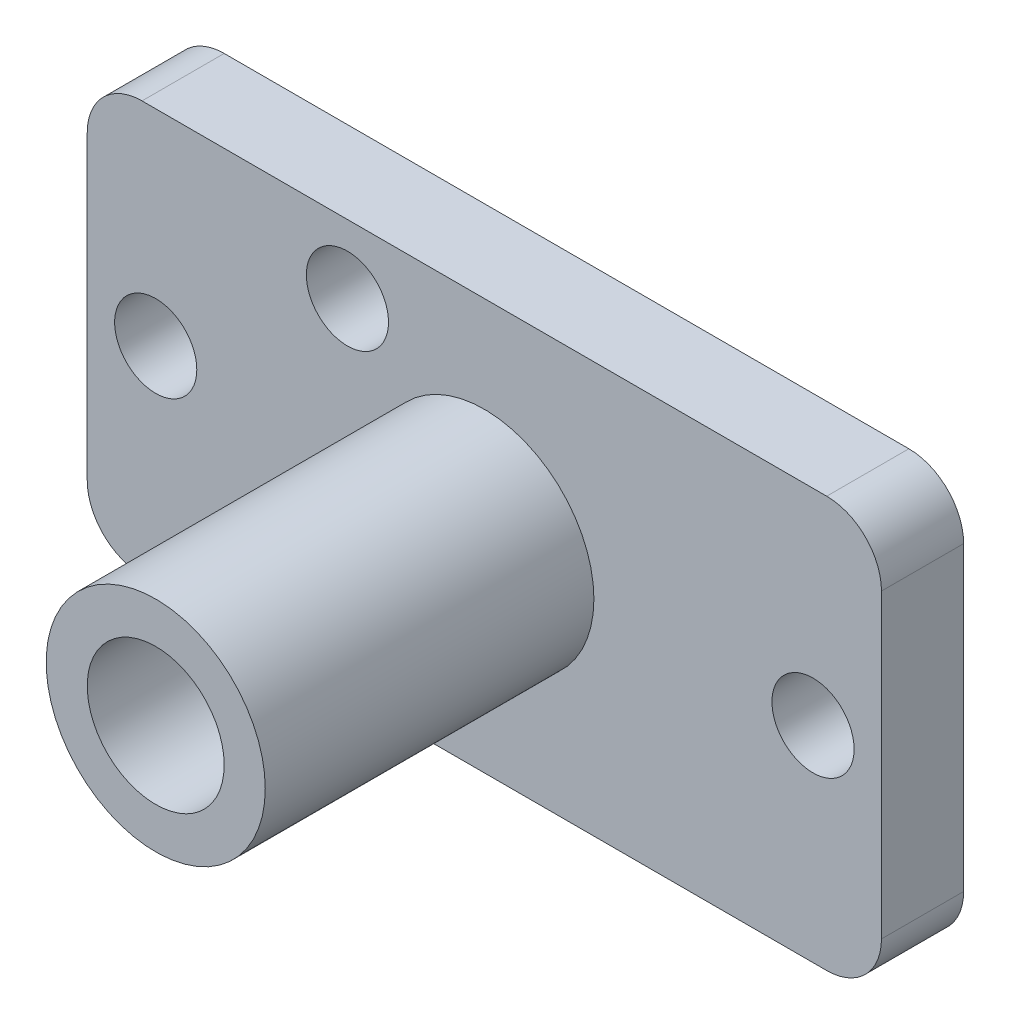
from build123d import *

# Parameters (mm, degrees)
SKETCH_1_W        = 29
SKETCH_1_H        = 15
SKETCH_1_R        = 1.5
SKETCH_1_R_2      = 2.5
EXTRUDE_1_DEPTH   = 3
SKETCH_1_3_R      = 4
SKETCH_1_3_R_2    = 2.5
EXTRUDE_1_2_DEPTH = 15
FILLET_1_R        = 2


with BuildPart() as part:
    # 草图1 → Extrude 1 (new body)
    # profile 1 of 2: a face of its own
    with BuildSketch(Plane.XY):
        with Locations((14.5, 7.5)):
            Rectangle(SKETCH_1_W, SKETCH_1_H)
        with Locations((9.5, 2.5)):
            Circle(SKETCH_1_R, mode=Mode.SUBTRACT)
        with Locations((9.5, 12.5)):
            Circle(SKETCH_1_R, mode=Mode.SUBTRACT)
        with Locations((26.5, 7.5)):
            Circle(SKETCH_1_R, mode=Mode.SUBTRACT)
        with Locations((2.5, 7.5)):
            Circle(SKETCH_1_R, mode=Mode.SUBTRACT)
        with Locations((14.5, 7.5)):
            Circle(SKETCH_1_R_2, mode=Mode.SUBTRACT)
    # profile 2 of 2: a face of its own
    with BuildSketch(Plane.XY):
        with Locations((14.5, 7.5)):
            Circle(SKETCH_1_R_2)
    extrude(amount=EXTRUDE_1_DEPTH)

    # 草图1<3> → Extrude 1 2 (add)
    with BuildSketch(Plane.XY):
        with Locations((14.5, 7.5)):
            Circle(SKETCH_1_3_R)
        with Locations((14.5, 7.5)):
            Circle(SKETCH_1_3_R_2, mode=Mode.SUBTRACT)
    extrude(amount=EXTRUDE_1_2_DEPTH)

    # 圆角1
    fillet_1_edges = [part.edges().sort_by_distance(p)[0] for p in [
        (0, 0, 1.5),
        (0, 15, 1.5),
        (29, 15, 1.5),
        (29, 0, 1.5),
    ]]
    fillet(fillet_1_edges, radius=FILLET_1_R)


solid = part.part
